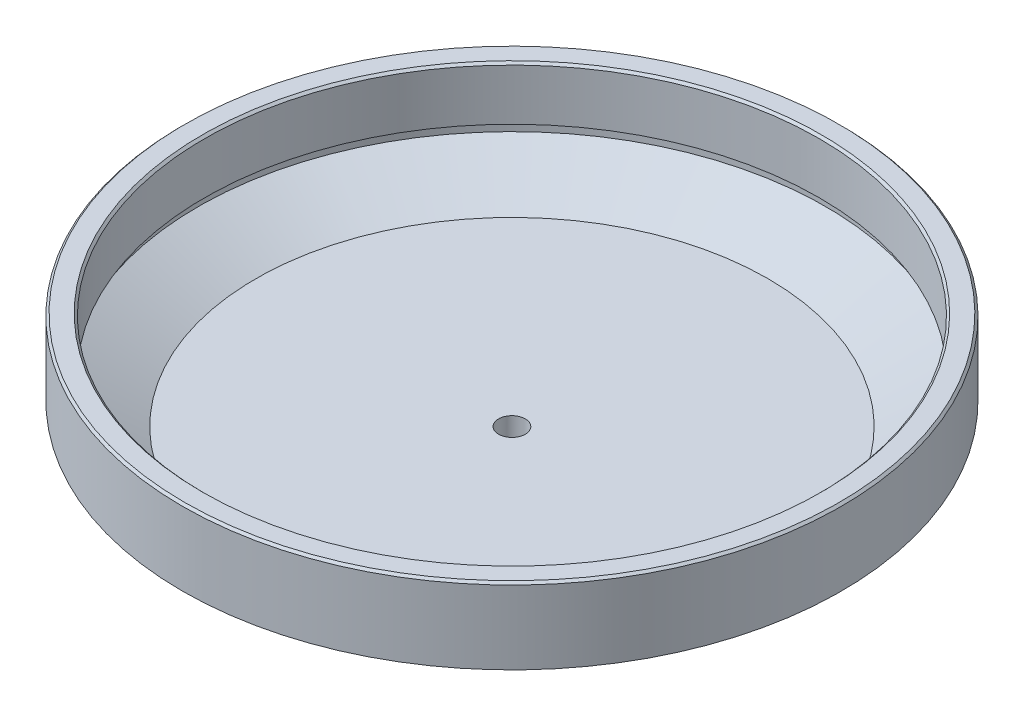
from build123d import *

# Parameters (mm, degrees)
CHAMFER_1_SIZE = 0.5


with BuildPart() as part:
    # Эскиз1 → Повернуть1 (revolve)
    with BuildSketch(Plane.XY):
        Polygon((-74, 28), (-74, 11), (-54.947441117, 0), (-3, 0), (-3, 6), (-57.509618943, 6), (-70.5, 13.5), (-70.5, 16), (-69, 16), (-69, 28), align=None)
    revolve(axis=Axis((0, 26.168985987, 0), (0, -1, 0)))

    # Фаска1
    chamfer_1_edges = [part.edges().sort_by_distance(p)[0] for p in [
        (3, 0, 0),
        (74, 28, 0),
        (69, 28, 0),
    ]]
    chamfer(chamfer_1_edges, length=CHAMFER_1_SIZE)


solid = part.part
